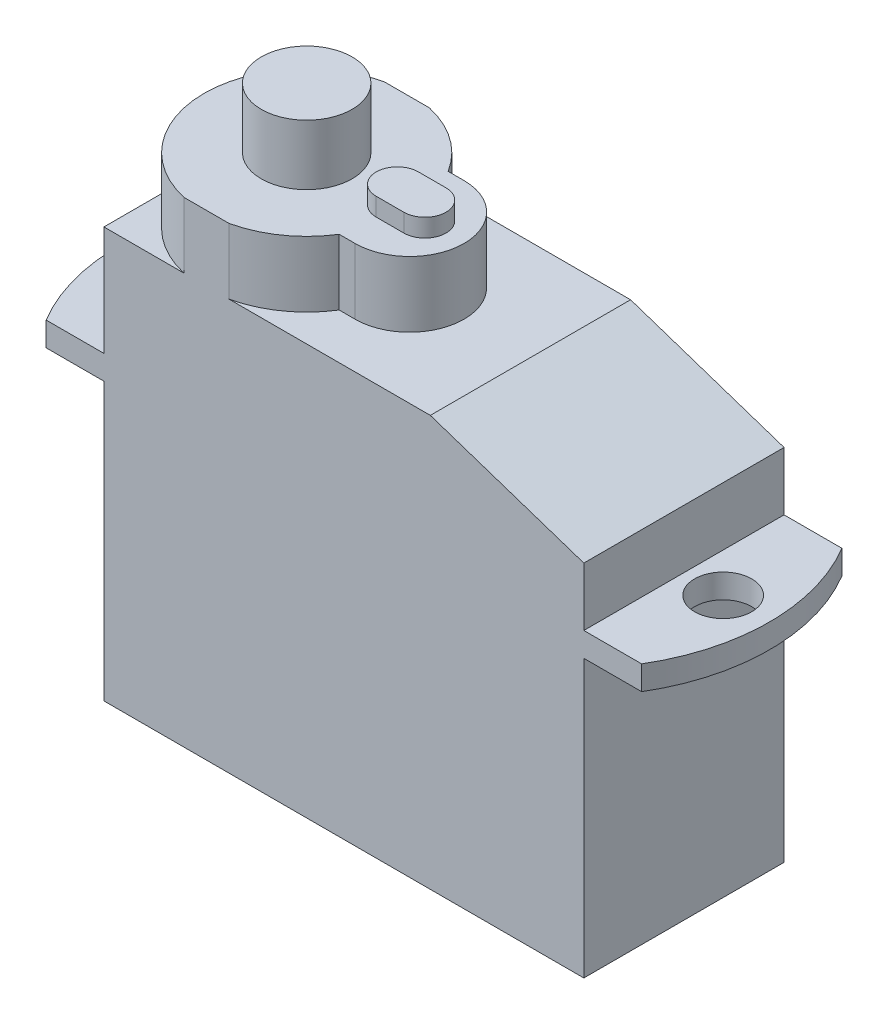
from build123d import *

# Parameters (mm, degrees)
SKETCH1_W           = 20.25
SKETCH1_H           = 8.45
BOSS_EXTRUDE1_DEPTH = 12.7
SKETCH2_W           = 8.45
SKETCH2_H           = 1.016
BOSS_EXTRUDE2_DEPTH = 3.61
CUT_EXTRUDE1_REACH  = 27.353
SKETCH3_R           = 1.205
SKETCH4_W           = 20.25
SKETCH4_H           = 8.45
BOSS_EXTRUDE3_DEPTH = 4.6228
CHAMFER1_SIZE       = 2.159
CHAMFER1_SIZE2      = 6.477
SKETCH5_R           = 1.9177
BOSS_EXTRUDE4_DEPTH = 5.3086
SKETCH6_R           = 1.9177
BOSS_EXTRUDE5_DEPTH = 2.7686
BOSS_EXTRUDE6_DEPTH = 0.762
SKETCH8_W           = 2.54
SKETCH8_H           = 0.8636
CUT_EXTRUDE2_DEPTH  = 1.6002
SKETCH9_R           = 0.381
BOSS_EXTRUDE9_DEPTH = 1.6002


with BuildPart() as part:
    # Sketch1 → Boss-Extrude1 (new body)
    with BuildSketch(Plane(origin=(0, 0, 0), x_dir=(1, 0, 0), z_dir=(0, 1, 0))):
        with Locations((-10.125, -4.225)):
            Rectangle(SKETCH1_W, SKETCH1_H)
    extrude(amount=BOSS_EXTRUDE1_DEPTH)

    # Sketch2 → Boss-Extrude2 (add)
    with BuildSketch(Plane(origin=(0, 0, 0), x_dir=(0, 0, -1), z_dir=(1, 0, 0))):
        with Locations((-4.225, 12.192)):
            Rectangle(SKETCH2_W, SKETCH2_H)
    boss_extrude2 = extrude(amount=BOSS_EXTRUDE2_DEPTH)

    # Sketch3 → Cut-Extrude1 (cut, up to next)
    with BuildSketch(Plane(origin=(0, 12.7, 0), x_dir=(1, 0, 0), z_dir=(0, 1, 0)), mode=Mode.PRIVATE) as cut_extrude1_sk1:
        with BuildLine():
            ThreePointArc((3.61, -4.225), (3.312097542, -6.417003935), (2.44, -8.45))
            Line((2.44, -8.45), (3.61, -8.45))
            Line((3.61, -8.45), (3.61, -4.225))
        make_face()
    cut_extrude1_tool1 = extrude(cut_extrude1_sk1.sketch, amount=-CUT_EXTRUDE1_REACH, mode=Mode.PRIVATE) & part.part
    # Sketch3 → Cut-Extrude1 (cut, up to next)
    with BuildSketch(Plane(origin=(0, 12.7, 0), x_dir=(1, 0, 0), z_dir=(0, 1, 0)), mode=Mode.PRIVATE) as cut_extrude1_sk2:
        with BuildLine():
            ThreePointArc((2.44, 0), (3.312097542, -2.032996065), (3.61, -4.225))
            Line((3.61, -4.225), (3.61, 0))
            Line((3.61, 0), (2.44, 0))
        make_face()
    cut_extrude1_tool2 = extrude(cut_extrude1_sk2.sketch, amount=-CUT_EXTRUDE1_REACH, mode=Mode.PRIVATE) & part.part
    # Sketch3 → Cut-Extrude1 (cut, up to next)
    with BuildSketch(Plane(origin=(0, 12.7, 0), x_dir=(1, 0, 0), z_dir=(0, 1, 0)), mode=Mode.PRIVATE) as cut_extrude1_sk3:
        with Locations(Location((1.655, -4.225, 0), (0, 0, 270))):
            Circle(SKETCH3_R)
    cut_extrude1_tool3 = extrude(cut_extrude1_sk3.sketch, amount=-CUT_EXTRUDE1_REACH, mode=Mode.PRIVATE) & part.part
    cut_extrude1_1 = cut_extrude1_tool1.solids().sort_by_distance((3.263745, 12.7, 7.409386))[0]
    add(cut_extrude1_1, mode=Mode.SUBTRACT)
    cut_extrude1_2 = cut_extrude1_tool2.solids().sort_by_distance((3.263745, 12.7, 1.040614))[0]
    add(cut_extrude1_2, mode=Mode.SUBTRACT)
    cut_extrude1_3 = cut_extrude1_tool3.solids().sort_by_distance((1.655, 12.7, 4.225))[0]
    add(cut_extrude1_3, mode=Mode.SUBTRACT)
    cut_extrude1 = cut_extrude1_1 + cut_extrude1_2 + cut_extrude1_3  # Cut-Extrude1 as one shape, for the pattern or mirror that repeats it

    # Mirror1: Boss-Extrude2, Cut-Extrude1 across plane
    add(boss_extrude2.mirror(Plane(origin=(-10.125, 0, 0), x_dir=(0, 0, 1), z_dir=(1, 0, 0))))
    add(cut_extrude1.mirror(Plane(origin=(-10.125, 0, 0), x_dir=(0, 0, 1), z_dir=(1, 0, 0))), mode=Mode.SUBTRACT)

    # Sketch4 → Boss-Extrude3 (add)
    with BuildSketch(Plane(origin=(0, 12.7, 0), x_dir=(1, 0, 0), z_dir=(0, 1, 0))):
        with Locations((-10.125, -4.225)):
            Rectangle(SKETCH4_W, SKETCH4_H)
    extrude(amount=BOSS_EXTRUDE3_DEPTH)

    # Chamfer1
    chamfer1_edges = [part.edges().sort_by_distance(p)[0] for p in [
        (0, 17.3228, 4.225),
    ]]
    chamfer1_side = [part.faces().sort_by_distance(p)[0] for p in [
        (0, 15.0114, 4.225),
    ]]
    chamfer(chamfer1_edges, length=CHAMFER1_SIZE, length2=CHAMFER1_SIZE2, reference=chamfer1_side[0])

    # Sketch5 → Boss-Extrude4 (add)
    with BuildSketch(Plane(origin=(0, 17.3228, 0), x_dir=(1, 0, 0), z_dir=(0, 1, 0))):
        with Locations(Location((-15.9193, -4.225, 0), (0, 0, 90))):
            Circle(SKETCH5_R)
    extrude(amount=BOSS_EXTRUDE4_DEPTH)

    # Sketch6 → Boss-Extrude5 (add)
    # profile 1 of 2: a face of its own
    with BuildSketch(Plane(origin=(0, 17.3228, 0), x_dir=(1, 0, 0), z_dir=(0, 1, 0))):
        with BuildLine():
            Line((-11.5759, -1.9263), (-12.249021972, -1.9263))
            ThreePointArc((-12.249021972, -1.9263), (-11.5886, -4.225), (-12.249021972, -6.5237))
            Line((-12.249021972, -6.5237), (-11.5759, -6.5237))
            ThreePointArc((-11.5759, -6.5237), (-9.2772, -4.225), (-11.5759, -1.9263))
        make_face()
    # profile 2 of 2: a face of its own
    with BuildSketch(Plane(origin=(0, 17.3228, 0), x_dir=(1, 0, 0), z_dir=(0, 1, 0))):
        with BuildLine():
            Line((-14.968333392, 0), (-16.870266608, 0))
            ThreePointArc((-16.870266608, 0), (-20.25, -4.225), (-16.870266608, -8.45))
            Line((-16.870266608, -8.45), (-14.968333392, -8.45))
            ThreePointArc((-14.968333392, -8.45), (-13.415975527, -7.758883002), (-12.249021972, -6.5237))
            ThreePointArc((-12.249021972, -6.5237), (-11.5886, -4.225), (-12.249021972, -1.9263))
            ThreePointArc((-12.249021972, -1.9263), (-13.415975527, -0.691116998), (-14.968333392, 0))
        make_face()
        with Locations(Location((-15.9193, -4.225, 0), (0, 0, 270))):
            Circle(SKETCH6_R, mode=Mode.SUBTRACT)
    extrude(amount=BOSS_EXTRUDE5_DEPTH)

    # Sketch7 → Boss-Extrude6 (add)
    with BuildSketch(Plane(origin=(0, 20.0914, 0), x_dir=(1, 0, 0), z_dir=(0, 1, 0))):
        with BuildLine():
            Line((-10.0392, -4.225), (-12.9856, -4.225))
            ThreePointArc((-12.9856, -4.225), (-12.724790977, -4.854648681), (-12.095142296, -5.115457704))
            Line((-12.095142296, -5.115457704), (-10.929657704, -5.115457704))
            ThreePointArc((-10.929657704, -5.115457704), (-10.300009023, -4.854648681), (-10.0392, -4.225))
        make_face()
        with BuildLine():
            ThreePointArc((-12.095142296, -3.334542296), (-12.724790977, -3.595351319), (-12.9856, -4.225))
            Line((-12.9856, -4.225), (-10.0392, -4.225))
            ThreePointArc((-10.0392, -4.225), (-10.300009023, -3.595351319), (-10.929657704, -3.334542296))
            Line((-10.929657704, -3.334542296), (-12.095142296, -3.334542296))
        make_face()
    extrude(amount=BOSS_EXTRUDE6_DEPTH)

    # Sketch8 → Cut-Extrude2 (cut)
    with BuildSketch(Plane.ZY.offset(20.25)):
        with Locations((4.225, 0.4318)):
            Rectangle(SKETCH8_W, SKETCH8_H)
    extrude(amount=-CUT_EXTRUDE2_DEPTH, mode=Mode.SUBTRACT)

    # Sketch9 → Boss-Extrude9 (add)
    with BuildSketch(Plane.ZY.offset(18.6498)):
        with Locations((4.961591366, 0.4318)):
            Circle(SKETCH9_R)
        with Locations((4.225, 0.435366491)):
            Circle(SKETCH9_R)
        with Locations((3.488408634, 0.4318)):
            Circle(SKETCH9_R)
    extrude(amount=BOSS_EXTRUDE9_DEPTH)


solid = part.part
